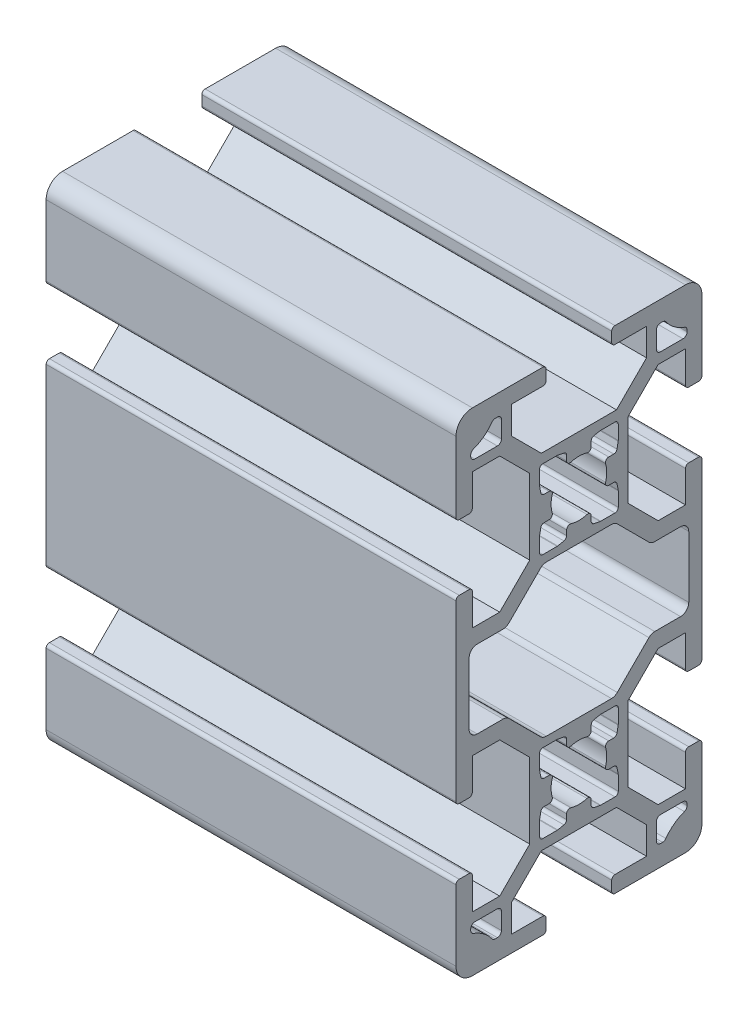
from build123d import *

# Parameters (mm, degrees)
BOSS_EXTRUDE1_DEPTH = 50


with BuildPart() as part:
    # Sketch1 → Boss-Extrude1 (new body)
    with BuildSketch(Plane(origin=(0, 0, 0), x_dir=(0, 0, -1), z_dir=(1, 0, 0))):
        with BuildLine():
            Line((-15, -19.4), (-15, -28))
            ThreePointArc((-15, -28), (-14.414213562, -29.414213562), (-13, -30))
            Line((-13, -30), (-4.4, -30))
            ThreePointArc((-4.4, -30), (-4.117157288, -29.882842712), (-4, -29.6))
            Line((-4, -29.6), (-4, -28.4))
            ThreePointArc((-4, -28.4), (-4.117157288, -28.117157288), (-4.4, -28))
            Line((-4.4, -28), (-8.25, -28))
            Line((-8.25, -28), (-8.25, -24.664213562))
            Line((-8.25, -24.664213562), (-4.585786438, -21))
            Line((-4.585786438, -21), (4.585786438, -21))
            Line((4.585786438, -21), (8.25, -24.664213562))
            Line((8.25, -24.664213562), (8.25, -28))
            Line((8.25, -28), (4.4, -28))
            ThreePointArc((4.4, -28), (4.117157288, -28.117157288), (4, -28.4))
            Line((4, -28.4), (4, -29.6))
            ThreePointArc((4, -29.6), (4.117157288, -29.882842712), (4.4, -30))
            Line((4.4, -30), (13, -30))
            ThreePointArc((13, -30), (14.414213562, -29.414213562), (15, -28))
            Line((15, -28), (15, -19.4))
            ThreePointArc((15, -19.4), (14.882842712, -19.117157288), (14.6, -19))
            Line((14.6, -19), (13.4, -19))
            ThreePointArc((13.4, -19), (13.117157288, -19.117157288), (13, -19.4))
            Line((13, -19.4), (13, -23.25))
            Line((13, -23.25), (9.664213562, -23.25))
            Line((9.664213562, -23.25), (6, -19.585786438))
            Line((6, -19.585786438), (6, -10.414213562))
            Line((6, -10.414213562), (9.664213562, -6.75))
            Line((9.664213562, -6.75), (13, -6.75))
            Line((13, -6.75), (13, -10.6))
            ThreePointArc((13, -10.6), (13.117157288, -10.882842712), (13.4, -11))
            Line((13.4, -11), (14.6, -11))
            ThreePointArc((14.6, -11), (14.882842712, -10.882842712), (15, -10.6))
            Line((15, -10.6), (15, 10.6))
            ThreePointArc((15, 10.6), (14.882842712, 10.882842712), (14.6, 11))
            Line((14.6, 11), (13.4, 11))
            ThreePointArc((13.4, 11), (13.117157288, 10.882842712), (13, 10.6))
            Line((13, 10.6), (13, 6.75))
            Line((13, 6.75), (9.664213562, 6.75))
            Line((9.664213562, 6.75), (6, 10.414213562))
            Line((6, 10.414213562), (6, 19.585786438))
            Line((6, 19.585786438), (9.664213562, 23.25))
            Line((9.664213562, 23.25), (13, 23.25))
            Line((13, 23.25), (13, 19.4))
            ThreePointArc((13, 19.4), (13.117157288, 19.117157288), (13.4, 19))
            Line((13.4, 19), (14.6, 19))
            ThreePointArc((14.6, 19), (14.882842712, 19.117157288), (15, 19.4))
            Line((15, 19.4), (15, 28))
            ThreePointArc((15, 28), (14.414213562, 29.414213562), (13, 30))
            Line((13, 30), (4.4, 30))
            ThreePointArc((4.4, 30), (4.117157288, 29.882842712), (4, 29.6))
            Line((4, 29.6), (4, 28.4))
            ThreePointArc((4, 28.4), (4.117157288, 28.117157288), (4.4, 28))
            Line((4.4, 28), (8.25, 28))
            Line((8.25, 28), (8.25, 24.664213562))
            Line((8.25, 24.664213562), (4.585786438, 21))
            Line((4.585786438, 21), (-4.585786438, 21))
            Line((-4.585786438, 21), (-8.25, 24.664213562))
            Line((-8.25, 24.664213562), (-8.25, 28))
            Line((-8.25, 28), (-4.4, 28))
            ThreePointArc((-4.4, 28), (-4.117157288, 28.117157288), (-4, 28.4))
            Line((-4, 28.4), (-4, 29.6))
            ThreePointArc((-4, 29.6), (-4.117157288, 29.882842712), (-4.4, 30))
            Line((-4.4, 30), (-13, 30))
            ThreePointArc((-13, 30), (-14.414213562, 29.414213562), (-15, 28))
            Line((-15, 28), (-15, 19.4))
            ThreePointArc((-15, 19.4), (-14.882842712, 19.117157288), (-14.6, 19))
            Line((-14.6, 19), (-13.4, 19))
            ThreePointArc((-13.4, 19), (-13.117157288, 19.117157288), (-13, 19.4))
            Line((-13, 19.4), (-13, 23.25))
            Line((-13, 23.25), (-9.664213562, 23.25))
            Line((-9.664213562, 23.25), (-6, 19.585786438))
            Line((-6, 19.585786438), (-6, 10.414213562))
            Line((-6, 10.414213562), (-9.664213562, 6.75))
            Line((-9.664213562, 6.75), (-13, 6.75))
            Line((-13, 6.75), (-13, 10.6))
            ThreePointArc((-13, 10.6), (-13.117157288, 10.882842712), (-13.4, 11))
            Line((-13.4, 11), (-14.6, 11))
            ThreePointArc((-14.6, 11), (-14.882842712, 10.882842712), (-15, 10.6))
            Line((-15, 10.6), (-15, -10.6))
            ThreePointArc((-15, -10.6), (-14.882842712, -10.882842712), (-14.6, -11))
            Line((-14.6, -11), (-13.4, -11))
            ThreePointArc((-13.4, -11), (-13.117157288, -10.882842712), (-13, -10.6))
            Line((-13, -10.6), (-13, -6.75))
            Line((-13, -6.75), (-9.664213562, -6.75))
            Line((-9.664213562, -6.75), (-6, -10.414213562))
            Line((-6, -10.414213562), (-6, -19.585786438))
            Line((-6, -19.585786438), (-9.664213562, -23.25))
            Line((-9.664213562, -23.25), (-13, -23.25))
            Line((-13, -23.25), (-13, -19.4))
            ThreePointArc((-13, -19.4), (-13.117157288, -19.117157288), (-13.4, -19))
            Line((-13.4, -19), (-14.6, -19))
            ThreePointArc((-14.6, -19), (-14.882842712, -19.117157288), (-15, -19.4))
        make_face()
        with BuildLine():
            Line((-13.2, 25.115022568), (-13.2, 24.95))
            ThreePointArc((-13.2, 24.95), (-13.053553391, 24.596446609), (-12.7, 24.45))
            Line((-12.7, 24.45), (-9.95, 24.45))
            ThreePointArc((-9.95, 24.45), (-9.596446609, 24.596446609), (-9.45, 24.95))
            Line((-9.45, 24.95), (-9.45, 27))
            ThreePointArc((-9.45, 27), (-9.596446609, 27.353553391), (-9.95, 27.5))
            Line((-9.95, 27.5), (-10.201162948, 27.5))
            ThreePointArc((-10.201162948, 27.5), (-10.428949674, 27.445099099), (-10.606713613, 27.29245283))
            ThreePointArc((-10.606713613, 27.29245283), (-11.609362709, 26.268001037), (-12.869811321, 25.585303458))
            ThreePointArc((-12.869811321, 25.585303458), (-13.109210007, 25.4023328), (-13.2, 25.115022568))
        make_face(mode=Mode.SUBTRACT)
        with BuildLine():
            Line((9.45, 27), (9.45, 24.95))
            ThreePointArc((9.45, 24.95), (9.596446609, 24.596446609), (9.95, 24.45))
            Line((9.95, 24.45), (12.7, 24.45))
            ThreePointArc((12.7, 24.45), (13.053553391, 24.596446609), (13.2, 24.95))
            Line((13.2, 24.95), (13.2, 25.115022568))
            ThreePointArc((13.2, 25.115022568), (13.109210007, 25.4023328), (12.869811321, 25.585303458))
            ThreePointArc((12.869811321, 25.585303458), (11.609362709, 26.268001037), (10.606713613, 27.29245283))
            ThreePointArc((10.606713613, 27.29245283), (10.428949674, 27.445099099), (10.201162948, 27.5))
            Line((10.201162948, 27.5), (9.95, 27.5))
            ThreePointArc((9.95, 27.5), (9.596446609, 27.353553391), (9.45, 27))
        make_face(mode=Mode.SUBTRACT)
        with BuildLine():
            Line((-9.95, -24.45), (-12.7, -24.45))
            ThreePointArc((-12.7, -24.45), (-13.053553391, -24.596446609), (-13.2, -24.95))
            Line((-13.2, -24.95), (-13.2, -25.115022568))
            ThreePointArc((-13.2, -25.115022568), (-13.109210007, -25.4023328), (-12.869811321, -25.585303458))
            ThreePointArc((-12.869811321, -25.585303458), (-11.609362709, -26.268001037), (-10.606713613, -27.29245283))
            ThreePointArc((-10.606713613, -27.29245283), (-10.428949674, -27.445099099), (-10.201162948, -27.5))
            Line((-10.201162948, -27.5), (-9.95, -27.5))
            ThreePointArc((-9.95, -27.5), (-9.596446609, -27.353553391), (-9.45, -27))
            Line((-9.45, -27), (-9.45, -24.95))
            ThreePointArc((-9.45, -24.95), (-9.596446609, -24.596446609), (-9.95, -24.45))
        make_face(mode=Mode.SUBTRACT)
        with BuildLine():
            Line((-4.8, 19.4), (-4.8, 17.662238167))
            ThreePointArc((-4.8, 17.662238167), (-4.798158479, 17.623899866), (-4.792650873, 17.585914569))
            Line((-4.792650873, 17.585914569), (-4.644486783, 16.823676402))
            ThreePointArc((-4.644486783, 16.823676402), (-4.506267197, 16.591350167), (-4.251835909, 16.5))
            Line((-4.251835909, 16.5), (-3.637306696, 16.5))
            ThreePointArc((-3.637306696, 16.5), (-3.316124668, 16.338415824), (-3.254432307, 15.984210526))
            ThreePointArc((-3.254432307, 15.984210526), (-3.4, 15), (-3.254432307, 14.015789474))
            ThreePointArc((-3.254432307, 14.015789474), (-3.316124668, 13.661584176), (-3.637306696, 13.5))
            Line((-3.637306696, 13.5), (-4.251835909, 13.5))
            ThreePointArc((-4.251835909, 13.5), (-4.506267197, 13.408649833), (-4.644486783, 13.176323598))
            Line((-4.644486783, 13.176323598), (-4.792650873, 12.414085431))
            ThreePointArc((-4.792650873, 12.414085431), (-4.798158479, 12.376100134), (-4.8, 12.337761833))
            Line((-4.8, 12.337761833), (-4.8, 10.6))
            ThreePointArc((-4.8, 10.6), (-4.682842712, 10.317157288), (-4.4, 10.2))
            Line((-4.4, 10.2), (-2.662238167, 10.2))
            ThreePointArc((-2.662238167, 10.2), (-2.623899866, 10.201841521), (-2.585914569, 10.207349127))
            Line((-2.585914569, 10.207349127), (-1.823676402, 10.355513217))
            ThreePointArc((-1.823676402, 10.355513217), (-1.591350167, 10.493732803), (-1.5, 10.748164091))
            Line((-1.5, 10.748164091), (-1.5, 11.362693304))
            ThreePointArc((-1.5, 11.362693304), (-1.338415824, 11.683875332), (-0.984210526, 11.745567693))
            ThreePointArc((-0.984210526, 11.745567693), (0, 11.6), (0.984210526, 11.745567693))
            ThreePointArc((0.984210526, 11.745567693), (1.338415824, 11.683875332), (1.5, 11.362693304))
            Line((1.5, 11.362693304), (1.5, 10.748164091))
            ThreePointArc((1.5, 10.748164091), (1.591350167, 10.493732803), (1.823676402, 10.355513217))
            Line((1.823676402, 10.355513217), (2.585914569, 10.207349127))
            ThreePointArc((2.585914569, 10.207349127), (2.623899866, 10.201841521), (2.662238167, 10.2))
            Line((2.662238167, 10.2), (4.4, 10.2))
            ThreePointArc((4.4, 10.2), (4.682842712, 10.317157288), (4.8, 10.6))
            Line((4.8, 10.6), (4.8, 12.337761833))
            ThreePointArc((4.8, 12.337761833), (4.798158479, 12.376100134), (4.792650873, 12.414085431))
            Line((4.792650873, 12.414085431), (4.644486783, 13.176323598))
            ThreePointArc((4.644486783, 13.176323598), (4.506267197, 13.408649833), (4.251835909, 13.5))
            Line((4.251835909, 13.5), (3.637306696, 13.5))
            ThreePointArc((3.637306696, 13.5), (3.316124668, 13.661584176), (3.254432307, 14.015789474))
            ThreePointArc((3.254432307, 14.015789474), (3.4, 15), (3.254432307, 15.984210526))
            ThreePointArc((3.254432307, 15.984210526), (3.316124668, 16.338415824), (3.637306696, 16.5))
            Line((3.637306696, 16.5), (4.251835909, 16.5))
            ThreePointArc((4.251835909, 16.5), (4.506267197, 16.591350167), (4.644486783, 16.823676402))
            Line((4.644486783, 16.823676402), (4.792650873, 17.585914569))
            ThreePointArc((4.792650873, 17.585914569), (4.798158479, 17.623899866), (4.8, 17.662238167))
            Line((4.8, 17.662238167), (4.8, 19.4))
            ThreePointArc((4.8, 19.4), (4.682842712, 19.682842712), (4.4, 19.8))
            Line((4.4, 19.8), (2.662238167, 19.8))
            ThreePointArc((2.662238167, 19.8), (2.623899866, 19.798158479), (2.585914569, 19.792650873))
            Line((2.585914569, 19.792650873), (1.823676402, 19.644486783))
            ThreePointArc((1.823676402, 19.644486783), (1.591350167, 19.506267197), (1.5, 19.251835909))
            Line((1.5, 19.251835909), (1.5, 18.637306696))
            ThreePointArc((1.5, 18.637306696), (1.338415824, 18.316124668), (0.984210526, 18.254432307))
            ThreePointArc((0.984210526, 18.254432307), (0, 18.4), (-0.984210526, 18.254432307))
            ThreePointArc((-0.984210526, 18.254432307), (-1.338415824, 18.316124668), (-1.5, 18.637306696))
            Line((-1.5, 18.637306696), (-1.5, 19.251835909))
            ThreePointArc((-1.5, 19.251835909), (-1.591350167, 19.506267197), (-1.823676402, 19.644486783))
            Line((-1.823676402, 19.644486783), (-2.585914569, 19.792650873))
            ThreePointArc((-2.585914569, 19.792650873), (-2.623899866, 19.798158479), (-2.662238167, 19.8))
            Line((-2.662238167, 19.8), (-4.4, 19.8))
            ThreePointArc((-4.4, 19.8), (-4.682842712, 19.682842712), (-4.8, 19.4))
        make_face(mode=Mode.SUBTRACT)
        with BuildLine():
            Line((-13.4, 3.75), (-13.4, -3.75))
            ThreePointArc((-13.4, -3.75), (-13.107106781, -4.457106781), (-12.4, -4.75))
            Line((-12.4, -4.75), (-9.25, -4.75))
            ThreePointArc((-9.25, -4.75), (-8.867316568, -4.826120467), (-8.542893219, -5.042893219))
            Line((-8.542893219, -5.042893219), (-4.678679656, -8.907106781))
            ThreePointArc((-4.678679656, -8.907106781), (-4.354256308, -9.123879533), (-3.971572875, -9.2))
            Line((-3.971572875, -9.2), (3.971572875, -9.2))
            ThreePointArc((3.971572875, -9.2), (4.354256308, -9.123879533), (4.678679656, -8.907106781))
            Line((4.678679656, -8.907106781), (8.542893219, -5.042893219))
            ThreePointArc((8.542893219, -5.042893219), (8.867316568, -4.826120467), (9.25, -4.75))
            Line((9.25, -4.75), (12.4, -4.75))
            ThreePointArc((12.4, -4.75), (13.107106781, -4.457106781), (13.4, -3.75))
            Line((13.4, -3.75), (13.4, 3.75))
            ThreePointArc((13.4, 3.75), (13.107106781, 4.457106781), (12.4, 4.75))
            Line((12.4, 4.75), (9.25, 4.75))
            ThreePointArc((9.25, 4.75), (8.867316568, 4.826120467), (8.542893219, 5.042893219))
            Line((8.542893219, 5.042893219), (4.678679656, 8.907106781))
            ThreePointArc((4.678679656, 8.907106781), (4.354256308, 9.123879533), (3.971572875, 9.2))
            Line((3.971572875, 9.2), (-3.971572875, 9.2))
            ThreePointArc((-3.971572875, 9.2), (-4.354256308, 9.123879533), (-4.678679656, 8.907106781))
            Line((-4.678679656, 8.907106781), (-8.542893219, 5.042893219))
            ThreePointArc((-8.542893219, 5.042893219), (-8.867316568, 4.826120467), (-9.25, 4.75))
            Line((-9.25, 4.75), (-12.4, 4.75))
            ThreePointArc((-12.4, 4.75), (-13.107106781, 4.457106781), (-13.4, 3.75))
        make_face(mode=Mode.SUBTRACT)
        with BuildLine():
            Line((12.7, -24.45), (9.95, -24.45))
            ThreePointArc((9.95, -24.45), (9.596446609, -24.596446609), (9.45, -24.95))
            Line((9.45, -24.95), (9.45, -27))
            ThreePointArc((9.45, -27), (9.596446609, -27.353553391), (9.95, -27.5))
            Line((9.95, -27.5), (10.201162948, -27.5))
            ThreePointArc((10.201162948, -27.5), (10.428949674, -27.445099099), (10.606713613, -27.29245283))
            ThreePointArc((10.606713613, -27.29245283), (11.609362709, -26.268001037), (12.869811321, -25.585303458))
            ThreePointArc((12.869811321, -25.585303458), (13.109210007, -25.4023328), (13.2, -25.115022568))
            Line((13.2, -25.115022568), (13.2, -24.95))
            ThreePointArc((13.2, -24.95), (13.053553391, -24.596446609), (12.7, -24.45))
        make_face(mode=Mode.SUBTRACT)
        with BuildLine():
            Line((-4.8, -17.662238167), (-4.8, -19.4))
            ThreePointArc((-4.8, -19.4), (-4.682842712, -19.682842712), (-4.4, -19.8))
            Line((-4.4, -19.8), (-2.662238167, -19.8))
            ThreePointArc((-2.662238167, -19.8), (-2.623899866, -19.798158479), (-2.585914569, -19.792650873))
            Line((-2.585914569, -19.792650873), (-1.823676402, -19.644486783))
            ThreePointArc((-1.823676402, -19.644486783), (-1.591350167, -19.506267197), (-1.5, -19.251835909))
            Line((-1.5, -19.251835909), (-1.5, -18.637306696))
            ThreePointArc((-1.5, -18.637306696), (-1.338415824, -18.316124668), (-0.984210526, -18.254432307))
            ThreePointArc((-0.984210526, -18.254432307), (0, -18.4), (0.984210526, -18.254432307))
            ThreePointArc((0.984210526, -18.254432307), (1.338415824, -18.316124668), (1.5, -18.637306696))
            Line((1.5, -18.637306696), (1.5, -19.251835909))
            ThreePointArc((1.5, -19.251835909), (1.591350167, -19.506267197), (1.823676402, -19.644486783))
            Line((1.823676402, -19.644486783), (2.585914569, -19.792650873))
            ThreePointArc((2.585914569, -19.792650873), (2.623899866, -19.798158479), (2.662238167, -19.8))
            Line((2.662238167, -19.8), (4.4, -19.8))
            ThreePointArc((4.4, -19.8), (4.682842712, -19.682842712), (4.8, -19.4))
            Line((4.8, -19.4), (4.8, -17.662238167))
            ThreePointArc((4.8, -17.662238167), (4.798158479, -17.623899866), (4.792650873, -17.585914569))
            Line((4.792650873, -17.585914569), (4.644486783, -16.823676402))
            ThreePointArc((4.644486783, -16.823676402), (4.506267197, -16.591350167), (4.251835909, -16.5))
            Line((4.251835909, -16.5), (3.637306696, -16.5))
            ThreePointArc((3.637306696, -16.5), (3.316124668, -16.338415824), (3.254432307, -15.984210526))
            ThreePointArc((3.254432307, -15.984210526), (3.4, -15), (3.254432307, -14.015789474))
            ThreePointArc((3.254432307, -14.015789474), (3.316124668, -13.661584176), (3.637306696, -13.5))
            Line((3.637306696, -13.5), (4.251835909, -13.5))
            ThreePointArc((4.251835909, -13.5), (4.506267197, -13.408649833), (4.644486783, -13.176323598))
            Line((4.644486783, -13.176323598), (4.792650873, -12.414085431))
            ThreePointArc((4.792650873, -12.414085431), (4.798158479, -12.376100134), (4.8, -12.337761833))
            Line((4.8, -12.337761833), (4.8, -10.6))
            ThreePointArc((4.8, -10.6), (4.682842712, -10.317157288), (4.4, -10.2))
            Line((4.4, -10.2), (2.662238167, -10.2))
            ThreePointArc((2.662238167, -10.2), (2.623899866, -10.201841521), (2.585914569, -10.207349127))
            Line((2.585914569, -10.207349127), (1.823676402, -10.355513217))
            ThreePointArc((1.823676402, -10.355513217), (1.591350167, -10.493732803), (1.5, -10.748164091))
            Line((1.5, -10.748164091), (1.5, -11.362693304))
            ThreePointArc((1.5, -11.362693304), (1.338415824, -11.683875332), (0.984210526, -11.745567693))
            ThreePointArc((0.984210526, -11.745567693), (0, -11.6), (-0.984210526, -11.745567693))
            ThreePointArc((-0.984210526, -11.745567693), (-1.338415824, -11.683875332), (-1.5, -11.362693304))
            Line((-1.5, -11.362693304), (-1.5, -10.748164091))
            ThreePointArc((-1.5, -10.748164091), (-1.591350167, -10.493732803), (-1.823676402, -10.355513217))
            Line((-1.823676402, -10.355513217), (-2.585914569, -10.207349127))
            ThreePointArc((-2.585914569, -10.207349127), (-2.623899866, -10.201841521), (-2.662238167, -10.2))
            Line((-2.662238167, -10.2), (-4.4, -10.2))
            ThreePointArc((-4.4, -10.2), (-4.682842712, -10.317157288), (-4.8, -10.6))
            Line((-4.8, -10.6), (-4.8, -12.337761833))
            ThreePointArc((-4.8, -12.337761833), (-4.798158479, -12.376100134), (-4.792650873, -12.414085431))
            Line((-4.792650873, -12.414085431), (-4.644486783, -13.176323598))
            ThreePointArc((-4.644486783, -13.176323598), (-4.506267197, -13.408649833), (-4.251835909, -13.5))
            Line((-4.251835909, -13.5), (-3.637306696, -13.5))
            ThreePointArc((-3.637306696, -13.5), (-3.316124668, -13.661584176), (-3.254432307, -14.015789474))
            ThreePointArc((-3.254432307, -14.015789474), (-3.4, -15), (-3.254432307, -15.984210526))
            ThreePointArc((-3.254432307, -15.984210526), (-3.316124668, -16.338415824), (-3.637306696, -16.5))
            Line((-3.637306696, -16.5), (-4.251835909, -16.5))
            ThreePointArc((-4.251835909, -16.5), (-4.506267197, -16.591350167), (-4.644486783, -16.823676402))
            Line((-4.644486783, -16.823676402), (-4.792650873, -17.585914569))
            ThreePointArc((-4.792650873, -17.585914569), (-4.798158479, -17.623899866), (-4.8, -17.662238167))
        make_face(mode=Mode.SUBTRACT)
    extrude(amount=BOSS_EXTRUDE1_DEPTH)


solid = part.part
